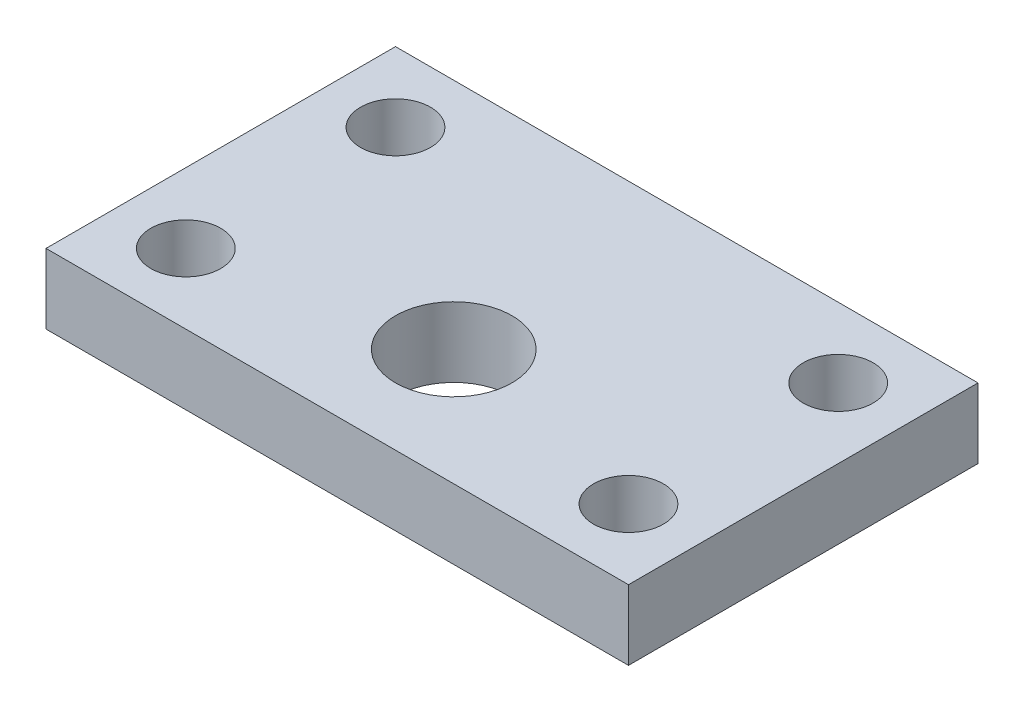
from build123d import *

# Parameters (mm, degrees)
SKETCH3_W           = 250
SKETCH3_H           = 150
BOSS_EXTRUDE2_DEPTH = 15
SKETCH5_R           = 25
CUT_EXTRUDE1_DEPTH  = 149.828760661
SKETCH6_R           = 15
CUT_EXTRUDE2_DEPTH  = 149.828760661


with BuildPart() as part:
    # Sketch3 → Boss-Extrude2 (new, symmetric)
    with BuildSketch(Plane(origin=(0, 0, 0), x_dir=(1, 0, 0), z_dir=(0, 1, 0))):
        Rectangle(SKETCH3_W, SKETCH3_H)
    extrude(amount=BOSS_EXTRUDE2_DEPTH, both=True)

    # Sketch5 → Cut-Extrude1 (cut, through all)
    with BuildSketch(Plane(origin=(0, 15, 0), x_dir=(1, 0, 0), z_dir=(0, 1, 0))):
        with Locations(Location((0, -25, 0), (0, 0, 270))):
            Circle(SKETCH5_R)
    extrude(amount=-CUT_EXTRUDE1_DEPTH, mode=Mode.SUBTRACT)

    # Sketch6 → Cut-Extrude2 (cut, through all)
    with BuildSketch(Plane(origin=(0, 15, 0), x_dir=(1, 0, 0), z_dir=(0, 1, 0))):
        with Locations(Location((-95, -45, 0), (0, 0, 270))):
            Circle(SKETCH6_R)
        with Locations(Location((95, -45, 0), (0, 0, 270))):
            Circle(SKETCH6_R)
        with Locations(Location((95, 45, 0), (0, 0, 270))):
            Circle(SKETCH6_R)
        with Locations(Location((-95, 45, 0), (0, 0, 270))):
            Circle(SKETCH6_R)
    extrude(amount=-CUT_EXTRUDE2_DEPTH, mode=Mode.SUBTRACT)


solid = part.part
